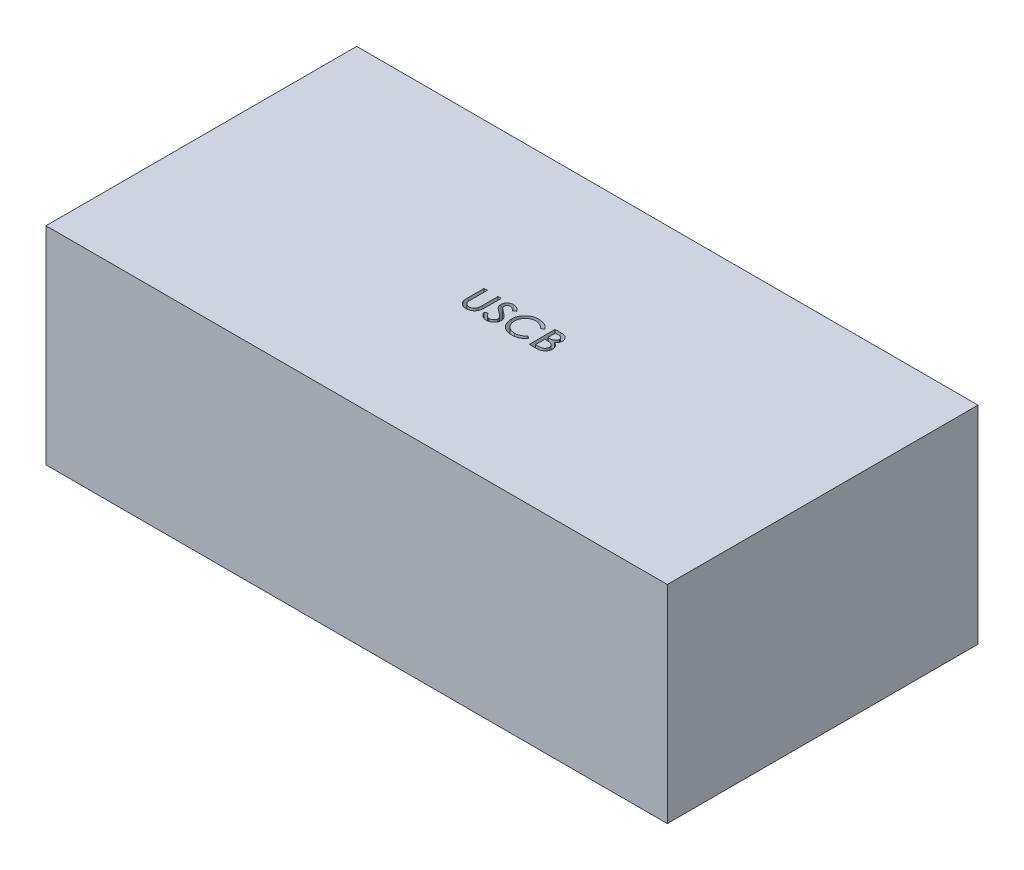
from build123d import *

# Parameters (mm, degrees)
SKETCH1_W           = 76.2
SKETCH1_H           = 38.1
BOSS_EXTRUDE1_DEPTH = 25.4
CUT_EXTRUDE1_DEPTH  = 50.595085442


with BuildPart() as part:
    # Sketch1 → Boss-Extrude1 (new body)
    with BuildSketch(Plane(origin=(0, 0, 0), x_dir=(1, 0, 0), z_dir=(0, 1, 0))):
        Rectangle(SKETCH1_W, SKETCH1_H)
    extrude(amount=BOSS_EXTRUDE1_DEPTH)

    # Sketch2 → Cut-Extrude1 (cut, through all)
    # profile 1 of 4: a face of its own
    with BuildSketch(Plane(origin=(0, 25.4, 0), x_dir=(1, 0, 0), z_dir=(0, 1, 0))):
        with BuildLine():
            Line((-4.58071498, 1.15783544), (-4.173663698, 1.15783544))
            Line((-4.173663698, 1.15783544), (-4.173663698, -0.759121691))
            add(Edge.make_bspline(
                [(-4.173663698, -0.759121691), (-4.173709576, -0.785834438), (-4.173796235, -0.836292794), (-4.173221861, -0.90795589), (-4.17183521, -0.971341599), (-4.170525458, -1.026885721), (-4.169496796, -1.074179761), (-4.167653211, -1.11341853), (-4.165195206, -1.144379332), (-4.163102951, -1.162360969), (-4.162215381, -1.169989079)],
                knots=[0, 0, 0, 0, 1.55908667, 2.944996726, 4.182614548, 5.259411187, 6.187768874, 6.943477064, 7.551805389, 8, 8, 8, 8], degree=3))
            add(Edge.make_bspline(
                [(-4.162215381, -1.169989079), (-4.157699651, -1.199988134), (-4.149063517, -1.257360002), (-4.127614846, -1.338177799), (-4.098829985, -1.409450039), (-4.063725268, -1.472755786), (-4.01890048, -1.528262144), (-3.965328334, -1.577612618), (-3.902382013, -1.622054127), (-3.831896645, -1.660492526), (-3.756739189, -1.691746244), (-3.680514713, -1.714893453), (-3.604372713, -1.729775179), (-3.553400029, -1.731414955), (-3.528105806, -1.732228662)],
                knots=[0, 0, 0, 0, 1.166957714, 2.231755086, 3.208991316, 4.118778005, 5.006904847, 5.942163703, 6.913386956, 7.965005362, 9.025668557, 10.040039382, 11.027406897, 12, 12, 12, 12], degree=3))
            add(Edge.make_bspline(
                [(-3.528105806, -1.732228662), (-3.50410258, -1.731509393), (-3.456455921, -1.730081634), (-3.386059991, -1.718180804), (-3.317579871, -1.699090781), (-3.25152961, -1.672271159), (-3.188666022, -1.638844714), (-3.130862917, -1.598627102), (-3.077944983, -1.553041736), (-3.03054433, -1.50130621), (-2.989400384, -1.442830696), (-2.952658668, -1.379361604), (-2.923554377, -1.309179216), (-2.908629276, -1.260017742), (-2.900992424, -1.234862877)],
                knots=[0, 0, 0, 0, 0.999732249, 1.98447917, 2.96624928, 3.957159324, 4.949250196, 5.927077037, 6.885351415, 7.854639871, 8.842631176, 9.859548065, 10.904776923, 12, 12, 12, 12], degree=3))
            add(Edge.make_bspline(
                [(-2.900992424, -1.234862877), (-2.898543903, -1.224073653), (-2.893101712, -1.200093056), (-2.886968287, -1.159950196), (-2.881996149, -1.112194906), (-2.878427334, -1.056594198), (-2.875312285, -0.993196562), (-2.872633661, -0.921962338), (-2.871619313, -0.843078662), (-2.871278079, -0.787954468), (-2.871099596, -0.759121691)],
                knots=[0, 0, 0, 0, 0.555909564, 1.235588686, 2.039259232, 2.968460287, 4.03530762, 5.229446682, 6.550858702, 8, 8, 8, 8], degree=3))
            Line((-2.871099596, -0.759121691), (-2.871099596, 1.15783544))
            Line((-2.871099596, 1.15783544), (-2.464048314, 1.15783544))
            Line((-2.464048314, 1.15783544), (-2.464048314, -0.752761515))
            add(Edge.make_bspline(
                [(-2.464048314, -0.752761515), (-2.464282658, -0.786474083), (-2.464741186, -0.852437566), (-2.468601497, -0.948943196), (-2.474876256, -1.040576385), (-2.483663263, -1.127359147), (-2.495356592, -1.209380918), (-2.508121022, -1.287016532), (-2.524869652, -1.359537786), (-2.543878791, -1.427849292), (-2.566866176, -1.492836145), (-2.595068477, -1.555626719), (-2.628799429, -1.616734248), (-2.668407812, -1.676062081), (-2.713775815, -1.733225987), (-2.764343865, -1.788901536), (-2.820346836, -1.842710771), (-2.880791232, -1.894770849), (-2.946267603, -1.942587725), (-3.015978404, -1.984519023), (-3.089720121, -2.019746879), (-3.167121385, -2.048187137), (-3.247984083, -2.071507048), (-3.332799269, -2.086940416), (-3.421228668, -2.096886808), (-3.481436327, -2.098003918), (-3.512205365, -2.098574816)],
                knots=[0, 0, 0, 0, 1.249746778, 2.445309111, 3.579791402, 4.654321124, 5.678008809, 6.650959404, 7.569940487, 8.435761916, 9.278480968, 10.122774478, 10.984627263, 11.863091158, 12.76404959, 13.687656952, 14.649240315, 15.641521383, 16.642911538, 17.65112545, 18.653008962, 19.667635542, 20.705108869, 21.768718231, 22.859706637, 24, 24, 24, 24], degree=3))
            add(Edge.make_bspline(
                [(-3.512205365, -2.098574816), (-3.543172762, -2.097860359), (-3.604156277, -2.096453391), (-3.693919929, -2.088442366), (-3.780180651, -2.073625185), (-3.863080214, -2.053259494), (-3.94302976, -2.027386792), (-4.019228033, -1.994463507), (-4.092924171, -1.957386409), (-4.161739238, -1.913129836), (-4.226908064, -1.865290424), (-4.285747696, -1.811961966), (-4.340651264, -1.756359537), (-4.387922434, -1.69527527), (-4.431155426, -1.631702109), (-4.467787086, -1.563720191), (-4.500328195, -1.492635251), (-4.516140953, -1.442609306), (-4.524109411, -1.417399936)],
                knots=[0, 0, 0, 0, 1.133329185, 2.231843898, 3.29426245, 4.332905112, 5.353485079, 6.365031746, 7.367763869, 8.368573437, 9.35539345, 10.32243748, 11.271609842, 12.210613971, 13.14444413, 14.081844494, 15.03339173, 16, 16, 16, 16], degree=3))
            add(Edge.make_bspline(
                [(-4.524109411, -1.417399936), (-4.528798381, -1.400496077), (-4.538913171, -1.364031995), (-4.549920273, -1.303803546), (-4.559117075, -1.234361933), (-4.567656034, -1.15572169), (-4.57279286, -1.067839418), (-4.577241697, -0.970948339), (-4.580741485, -0.864936934), (-4.580724048, -0.791137653), (-4.58071498, -0.752761515)],
                knots=[0, 0, 0, 0, 0.629181127, 1.357235188, 2.194217397, 3.14266044, 4.194662557, 5.352158634, 6.623104138, 8, 8, 8, 8], degree=3))
            Line((-4.58071498, -0.752761515), (-4.58071498, 1.15783544))
        make_face()
    # profile 2 of 4: a face of its own
    with BuildSketch(Plane(origin=(0, 25.4, 0), x_dir=(1, 0, 0), z_dir=(0, 1, 0))):
        with BuildLine():
            Line((-2.056997032, -1.387507108), (-1.711003442, -1.203061996))
            add(Edge.make_bspline(
                [(-1.711003442, -1.203061996), (-1.685788942, -1.244827869), (-1.637597048, -1.324654024), (-1.558463513, -1.432189332), (-1.479783345, -1.523888688), (-1.400779878, -1.599659503), (-1.320355695, -1.658284676), (-1.239331835, -1.700654312), (-1.157201189, -1.727285037), (-1.101670007, -1.730598504), (-1.074349796, -1.732228662)],
                knots=[0, 0, 0, 0, 1.354943589, 2.589672558, 3.704607527, 4.708856974, 5.624398268, 6.459549776, 7.242129862, 8, 8, 8, 8], degree=3))
            add(Edge.make_bspline(
                [(-1.074349796, -1.732228662), (-1.048844909, -1.731408829), (-0.998327066, -1.729784975), (-0.924100942, -1.715702161), (-0.852230401, -1.694244917), (-0.783960825, -1.663690278), (-0.720889115, -1.626257098), (-0.66521066, -1.581731936), (-0.617969043, -1.531322891), (-0.579030998, -1.475713796), (-0.548509036, -1.416340216), (-0.526040187, -1.354886922), (-0.512853214, -1.291176847), (-0.511092287, -1.24827899), (-0.51020216, -1.226594648)],
                knots=[0, 0, 0, 0, 1.0888553, 2.156709112, 3.216967111, 4.287545289, 5.343926646, 6.34269433, 7.323221176, 8.28571565, 9.233736345, 10.167849744, 11.073870434, 12, 12, 12, 12], degree=3))
            add(Edge.make_bspline(
                [(-0.51020216, -1.226594648), (-0.511449311, -1.201881342), (-0.513969519, -1.151941404), (-0.534197317, -1.077755029), (-0.56707118, -1.004294533), (-0.597480245, -0.95842851), (-0.613237016, -0.934662556)],
                knots=[0, 0, 0, 0, 0.941861274, 1.903286225, 2.913566088, 4, 4, 4, 4], degree=3))
            add(Edge.make_bspline(
                [(-0.613237016, -0.934662556), (-0.626861956, -0.917362668), (-0.655543612, -0.880944932), (-0.70409352, -0.826117466), (-0.760903285, -0.768924283), (-0.825880752, -0.709623405), (-0.897883813, -0.646886074), (-0.978135558, -0.58233377), (-1.066068663, -0.514875548), (-1.127689742, -0.469619297), (-1.159576158, -0.446201018)],
                knots=[0, 0, 0, 0, 0.718593868, 1.512701116, 2.388487339, 3.348232282, 4.383172848, 5.504845107, 6.708858268, 8, 8, 8, 8], degree=3))
            add(Edge.make_bspline(
                [(-1.159576158, -0.446201018), (-1.192091956, -0.422563084), (-1.254480668, -0.377208508), (-1.342380915, -0.310718489), (-1.421192041, -0.249411007), (-1.490309692, -0.193238144), (-1.549741724, -0.141711671), (-1.599362939, -0.095043023), (-1.64066714, -0.05451291), (-1.662862841, -0.027242349), (-1.672842384, -0.014981066)],
                knots=[0, 0, 0, 0, 1.435833971, 2.754963323, 3.936484598, 5.002077172, 5.935979083, 6.744956812, 7.435712417, 8, 8, 8, 8], degree=3))
            add(Edge.make_bspline(
                [(-1.672842384, -0.014981066), (-1.687411169, 0.003843222), (-1.716032719, 0.04082505), (-1.752268592, 0.100146297), (-1.783448749, 0.160243921), (-1.809130232, 0.221674388), (-1.829031835, 0.28424145), (-1.842723196, 0.348164524), (-1.852380845, 0.413189694), (-1.853106566, 0.457120392), (-1.853471391, 0.479204631)],
                knots=[0, 0, 0, 0, 1.064105702, 2.090521257, 3.104283852, 4.09061442, 5.065433238, 6.036507983, 7.012940167, 8, 8, 8, 8], degree=3))
            add(Edge.make_bspline(
                [(-1.853471391, 0.479204631), (-1.852322514, 0.513644634), (-1.850047822, 0.581833319), (-1.829720316, 0.681378585), (-1.796779242, 0.776227445), (-1.751815027, 0.865889679), (-1.694396544, 0.948696308), (-1.626099591, 1.023011993), (-1.546554635, 1.087250981), (-1.457884072, 1.141379128), (-1.362307659, 1.185277414), (-1.261643297, 1.216566103), (-1.157111318, 1.235534414), (-1.086088654, 1.237999435), (-1.050181126, 1.239245697)],
                knots=[0, 0, 0, 0, 1.004530234, 1.988896367, 2.951881425, 3.928924249, 4.907494835, 5.884204368, 6.865296418, 7.88218147, 8.909671266, 9.927572845, 10.952225504, 12, 12, 12, 12], degree=3))
            add(Edge.make_bspline(
                [(-1.050181126, 1.239245697), (-1.009410178, 1.237786358), (-0.928663116, 1.23489613), (-0.809634357, 1.215309525), (-0.69581362, 1.180045186), (-0.604143577, 1.141119906), (-0.532932723, 1.101321871), (-0.479074497, 1.065377432), (-0.423872593, 1.024698561), (-0.369075419, 0.977257447), (-0.312547279, 0.925349468), (-0.257182868, 0.866153026), (-0.199478464, 0.803060744), (-0.162699789, 0.757560191), (-0.143856006, 0.7342477)],
                knots=[0, 0, 0, 0, 1.360590218, 2.69465552, 4.010645498, 5.328858611, 6.009843139, 6.729980544, 7.488405022, 8.296451933, 9.147430815, 10.048128915, 10.999946711, 12, 12, 12, 12], degree=3))
            Line((-0.143856006, 0.7342477), (-0.475857208, 0.506553389))
            add(Edge.make_bspline(
                [(-0.475857208, 0.506553389), (-0.493183452, 0.525053128), (-0.526497469, 0.560623483), (-0.575501698, 0.611067681), (-0.62186638, 0.656337744), (-0.665732225, 0.696226575), (-0.706116043, 0.731445541), (-0.744152582, 0.760807051), (-0.778652391, 0.786041936), (-0.821780212, 0.811052491), (-0.874651667, 0.835822572), (-0.939724022, 0.858109963), (-1.00798212, 0.870021203), (-1.054168331, 0.87193269), (-1.077529884, 0.872899543)],
                knots=[0, 0, 0, 0, 1.253377364, 2.409930098, 3.477532466, 4.457083962, 5.341772995, 6.126101147, 6.832963523, 7.453284126, 8.588253012, 9.715448048, 10.844445545, 12, 12, 12, 12], degree=3))
            add(Edge.make_bspline(
                [(-1.077529884, 0.872899543), (-1.102465848, 0.871734233), (-1.150943398, 0.869468776), (-1.220578856, 0.85006895), (-1.284590676, 0.819456685), (-1.341067048, 0.776132133), (-1.388008441, 0.722507938), (-1.422434321, 0.659693986), (-1.442581295, 0.588109138), (-1.445104392, 0.537850077), (-1.446420109, 0.51164153)],
                knots=[0, 0, 0, 0, 1.033513523, 2.009234674, 2.977584268, 3.963375862, 4.942860848, 5.915719707, 6.913112236, 8, 8, 8, 8], degree=3))
            add(Edge.make_bspline(
                [(-1.446420109, 0.51164153), (-1.445907464, 0.494659236), (-1.444883415, 0.460735723), (-1.437361487, 0.410485355), (-1.423457207, 0.361931579), (-1.405837674, 0.314050997), (-1.381176365, 0.267112639), (-1.349768716, 0.221042387), (-1.312484938, 0.174512959), (-1.283871009, 0.145262319), (-1.26897119, 0.130030953)],
                knots=[0, 0, 0, 0, 0.940834015, 1.879392378, 2.805520916, 3.734846727, 4.701501436, 5.734192883, 6.820151034, 8, 8, 8, 8], degree=3))
            add(Edge.make_bspline(
                [(-1.26897119, 0.130030953), (-1.261426778, 0.122933542), (-1.244110769, 0.106643494), (-1.212351349, 0.081698599), (-1.173657446, 0.050424364), (-1.127492625, 0.013331239), (-1.072338883, -0.027566933), (-1.010235448, -0.075002488), (-0.939609857, -0.126839931), (-0.889910431, -0.163181495), (-0.863827961, -0.182253702)],
                knots=[0, 0, 0, 0, 0.485581606, 1.114511607, 1.892484918, 2.819534315, 3.891398566, 5.11240712, 6.484579029, 8, 8, 8, 8], degree=3))
            add(Edge.make_bspline(
                [(-0.863827961, -0.182253702), (-0.828293538, -0.20815466), (-0.759550958, -0.258260964), (-0.661899763, -0.33383973), (-0.573832177, -0.407925511), (-0.49312164, -0.477933626), (-0.422497646, -0.546800779), (-0.360636939, -0.613110978), (-0.306762665, -0.676216984), (-0.249224294, -0.756675377), (-0.191697458, -0.855866753), (-0.140256576, -0.975758167), (-0.10956019, -1.096595384), (-0.105268915, -1.177247203), (-0.103150878, -1.217054383)],
                knots=[0, 0, 0, 0, 1.186540699, 2.295404303, 3.331123753, 4.291760032, 5.17774712, 5.991329992, 6.738459906, 7.414799035, 8.65800623, 9.82461674, 10.926299804, 12, 12, 12, 12], degree=3))
            add(Edge.make_bspline(
                [(-0.103150878, -1.217054383), (-0.104052095, -1.245296998), (-0.105843333, -1.301431353), (-0.118830301, -1.38442959), (-0.140439473, -1.46510103), (-0.171528183, -1.543105024), (-0.210304956, -1.61917366), (-0.25838556, -1.692641898), (-0.315613278, -1.763226636), (-0.379573768, -1.831354392), (-0.450297921, -1.893966456), (-0.526141545, -1.94907333), (-0.606873085, -1.995109305), (-0.691870432, -2.032459509), (-0.780634861, -2.062895285), (-0.874043569, -2.083741247), (-0.971634569, -2.095773843), (-1.038063489, -2.09763132), (-1.071805726, -2.098574816)],
                knots=[0, 0, 0, 0, 0.932646097, 1.853705421, 2.767602683, 3.685675702, 4.622099834, 5.5835355, 6.579838097, 7.620108014, 8.666886363, 9.695041649, 10.711275682, 11.730160242, 12.757671447, 13.80585424, 14.885494678, 16, 16, 16, 16], degree=3))
            add(Edge.make_bspline(
                [(-1.071805726, -2.098574816), (-1.096410948, -2.098028303), (-1.144873062, -2.096951897), (-1.21681883, -2.090124066), (-1.286831026, -2.077001042), (-1.3552935, -2.060034294), (-1.422248983, -2.038429432), (-1.486834602, -2.010792852), (-1.55012586, -1.97904842), (-1.611759685, -1.941878979), (-1.671814674, -1.89835649), (-1.730632111, -1.84783544), (-1.78787034, -1.789427733), (-1.844510545, -1.723892207), (-1.899804435, -1.650491722), (-1.95362292, -1.569612244), (-2.006653166, -1.481514584), (-2.03988498, -1.41946057), (-2.056997032, -1.387507108)],
                knots=[0, 0, 0, 0, 0.916943493, 1.805999526, 2.689245248, 3.568702553, 4.433092864, 5.307568578, 6.183755457, 7.069823058, 7.986358083, 8.944343836, 9.955449961, 11.030835633, 12.170024038, 13.377301724, 14.649494474, 16, 16, 16, 16], degree=3))
        make_face()
    # profile 3 of 4: a face of its own
    with BuildSketch(Plane(origin=(0, 25.4, 0), x_dir=(1, 0, 0), z_dir=(0, 1, 0))):
        with BuildLine():
            Line((3.478900404, 0.567611081), (3.154531414, 0.343732876))
            add(Edge.make_bspline(
                [(3.154531414, 0.343732876), (3.115681397, 0.386287298), (3.039627852, 0.46959266), (2.914386448, 0.578717543), (2.783316071, 0.670563243), (2.646232161, 0.74482398), (2.50298958, 0.802958371), (2.352834858, 0.843352055), (2.195611121, 0.868245771), (2.088447122, 0.871329166), (2.033868353, 0.872899543)],
                knots=[0, 0, 0, 0, 1.078723025, 2.111729107, 3.104379151, 4.071093171, 5.02612831, 5.993405043, 6.978038489, 8, 8, 8, 8], degree=3))
            add(Edge.make_bspline(
                [(2.033868353, 0.872899543), (2.005435292, 0.872489716), (1.94887057, 0.871674407), (1.865048313, 0.862710653), (1.782508179, 0.850441776), (1.701327824, 0.831800482), (1.621651468, 0.807430472), (1.542936231, 0.77916867), (1.466374164, 0.744163612), (1.391222555, 0.70525571), (1.318608988, 0.661492943), (1.250213458, 0.612886594), (1.1847916, 0.561608568), (1.124192997, 0.505234438), (1.067864638, 0.444753589), (1.014572635, 0.380927121), (0.965663942, 0.312924832), (0.921326547, 0.240950588), (0.880884062, 0.166076784), (0.846944137, 0.087754663), (0.817477857, 0.007312898), (0.793024817, -0.075667386), (0.774939182, -0.161437532), (0.761528936, -0.249764074), (0.752935216, -0.34045137), (0.752085359, -0.401872641), (0.751656815, -0.432844648)],
                knots=[0, 0, 0, 0, 1.002068956, 1.993515617, 2.969284448, 3.943018425, 4.926742606, 5.905741285, 6.889351865, 7.892340394, 8.888397413, 9.875523532, 10.849114049, 11.817064186, 12.790109362, 13.76151668, 14.746886598, 15.740472426, 16.740336546, 17.744438579, 18.747064952, 19.759451636, 20.791569268, 21.834966327, 22.908270136, 24, 24, 24, 24], degree=3))
            add(Edge.make_bspline(
                [(0.751656815, -0.432844648), (0.752637928, -0.479337128), (0.754558487, -0.57034757), (0.773121747, -0.703609754), (0.802086988, -0.830603972), (0.842803379, -0.951320198), (0.89541378, -1.065621295), (0.959778154, -1.173319481), (1.036266873, -1.274677356), (1.123611926, -1.368384793), (1.218826284, -1.454384042), (1.322021454, -1.527964044), (1.429663689, -1.591858579), (1.543880448, -1.642590249), (1.663057756, -1.682937891), (1.78811798, -1.711518609), (1.918672642, -1.729054791), (2.007736317, -1.731159978), (2.052948882, -1.732228662)],
                knots=[0, 0, 0, 0, 1.083728652, 2.12143175, 3.131304262, 4.117911469, 5.086904967, 6.060353746, 7.03835, 8.042493243, 9.043967071, 10.025107856, 10.993520914, 11.958418665, 12.934074928, 13.923564625, 14.94591178, 16, 16, 16, 16], degree=3))
            add(Edge.make_bspline(
                [(2.052948882, -1.732228662), (2.105415002, -1.730686406), (2.209038959, -1.72764035), (2.361405093, -1.701983287), (2.508213686, -1.660542599), (2.649623248, -1.602124154), (2.785749198, -1.527301962), (2.915952041, -1.43550072), (3.04095743, -1.32755054), (3.116939755, -1.245188703), (3.155803449, -1.203061996)],
                knots=[0, 0, 0, 0, 0.996377973, 1.967910503, 2.926842387, 3.889624876, 4.868586907, 5.872161968, 6.91164629, 8, 8, 8, 8], degree=3))
            Line((3.155803449, -1.203061996), (3.478900404, -1.425668165))
            add(Edge.make_bspline(
                [(3.478900404, -1.425668165), (3.457984492, -1.452193083), (3.416427295, -1.504894645), (3.349315529, -1.579438961), (3.278823035, -1.649547595), (3.204255644, -1.714570247), (3.125693134, -1.774443673), (3.043503607, -1.829861144), (2.95776604, -1.880734516), (2.868527277, -1.92651941), (2.776295701, -1.967497479), (2.680883006, -2.002005811), (2.583203625, -2.032447814), (2.482396278, -2.056280533), (2.37885449, -2.07559628), (2.2724179, -2.08856112), (2.163551909, -2.097336234), (2.090067646, -2.098159144), (2.052948882, -2.098574816)],
                knots=[0, 0, 0, 0, 0.990136069, 1.967271632, 2.938597646, 3.903378639, 4.8655934, 5.832714132, 6.808088679, 7.786607084, 8.77175572, 9.76479442, 10.759640537, 11.769709565, 12.799869661, 13.846050076, 14.911985293, 16, 16, 16, 16], degree=3))
            add(Edge.make_bspline(
                [(2.052948882, -2.098574816), (2.018800333, -2.09834339), (1.951487349, -2.097887208), (1.852008882, -2.090222505), (1.755166543, -2.079858049), (1.661221367, -2.064308848), (1.56973006, -2.045688456), (1.481439403, -2.021000035), (1.395151541, -1.99346051), (1.312121968, -1.960155303), (1.231724645, -1.923118278), (1.153676743, -1.882526343), (1.078746099, -1.836726016), (1.00687034, -1.786162136), (0.937203434, -1.732107611), (0.870449984, -1.673358899), (0.80591544, -1.610664116), (0.766000919, -1.565435499), (0.745932656, -1.542695409)],
                knots=[0, 0, 0, 0, 1.116169561, 2.200172621, 3.260333751, 4.299600589, 5.312386579, 6.311224183, 7.295427787, 8.272379731, 9.233840239, 10.188782295, 11.146938977, 12.102635432, 13.060741968, 14.028403985, 15.00871894, 16, 16, 16, 16], degree=3))
            add(Edge.make_bspline(
                [(0.745932656, -1.542695409), (0.713762484, -1.503212783), (0.649995853, -1.424951649), (0.568724265, -1.297742318), (0.498625437, -1.16534374), (0.442929142, -1.025869567), (0.398905666, -0.88096469), (0.366818671, -0.730186948), (0.348330569, -0.573020583), (0.345861083, -0.46617775), (0.344605532, -0.411856066)],
                knots=[0, 0, 0, 0, 0.995996121, 1.974230005, 2.94855815, 3.923972302, 4.908363682, 5.909282248, 6.937024559, 8, 8, 8, 8], degree=3))
            add(Edge.make_bspline(
                [(0.344605532, -0.411856066), (0.346022993, -0.354749103), (0.348811758, -0.242394718), (0.372298347, -0.077462283), (0.410566847, 0.080311604), (0.463165893, 0.231607772), (0.532865019, 0.375188393), (0.615985101, 0.512908822), (0.716505989, 0.642202975), (0.829481101, 0.764190494), (0.953777376, 0.875830879), (1.088007971, 0.972641149), (1.229306416, 1.055370368), (1.378193074, 1.123140735), (1.535071371, 1.175641116), (1.699681956, 1.211961129), (1.871671883, 1.234959109), (1.98884901, 1.237799716), (2.048496758, 1.239245697)],
                knots=[0, 0, 0, 0, 1.034323922, 2.034967744, 3.011348252, 3.972313581, 4.931003742, 5.898099022, 6.881526582, 7.89265862, 8.907395938, 9.903191422, 10.886146247, 11.869423756, 12.861842533, 13.877618994, 14.91962492, 16, 16, 16, 16], degree=3))
            add(Edge.make_bspline(
                [(2.048496758, 1.239245697), (2.086037008, 1.238811017), (2.160363194, 1.237950393), (2.27056028, 1.22944702), (2.377960882, 1.215489522), (2.482586449, 1.196263737), (2.584746655, 1.172506414), (2.683900821, 1.141528882), (2.780610788, 1.106141007), (2.874225575, 1.065283908), (2.964515463, 1.019832332), (3.05045682, 0.968557132), (3.132643484, 0.913426266), (3.210420352, 0.853290629), (3.284305822, 0.789141737), (3.353939051, 0.720241239), (3.418957239, 0.646309702), (3.458852449, 0.593931788), (3.478900404, 0.567611081)],
                knots=[0, 0, 0, 0, 1.097463626, 2.172875475, 3.229307817, 4.262776093, 5.282168658, 6.293918414, 7.298043722, 8.291879901, 9.278790577, 10.251524626, 11.216027204, 12.170719329, 13.124142787, 14.075306658, 15.032812027, 16, 16, 16, 16], degree=3))
        make_face()
    # profile 4 of 4: a face of its own
    with BuildSketch(Plane(origin=(0, 25.4, 0), x_dir=(1, 0, 0), z_dir=(0, 1, 0))):
        with BuildLine():
            Line((4.130182456, 1.15783544), (4.775104331, 1.15783544))
            add(Edge.make_bspline(
                [(4.775104331, 1.15783544), (4.806701987, 1.157726987), (4.868034471, 1.157516474), (4.957327679, 1.152008295), (5.041316935, 1.144425725), (5.120221426, 1.13487064), (5.193527819, 1.120425085), (5.26164269, 1.104349949), (5.324371797, 1.084604706), (5.399696128, 1.054356344), (5.485847332, 1.009756571), (5.57716289, 0.942765498), (5.656582232, 0.864334966), (5.722274981, 0.774719344), (5.774244248, 0.677501636), (5.812428861, 0.57537812), (5.835275516, 0.468976215), (5.83828519, 0.396630173), (5.83979784, 0.360269335)],
                knots=[0, 0, 0, 0, 1.007958579, 1.956493294, 2.853051435, 3.69876748, 4.490758369, 5.235590101, 5.930857791, 6.586533057, 7.824014415, 9.014592828, 10.186442765, 11.371570779, 12.545761065, 13.692928573, 14.840474926, 16, 16, 16, 16], degree=3))
            add(Edge.make_bspline(
                [(5.83979784, 0.360269335), (5.838499925, 0.326272833), (5.835934758, 0.25908301), (5.817708282, 0.160019395), (5.787116458, 0.064872251), (5.744421885, -0.024871378), (5.692834094, -0.107736735), (5.629254484, -0.178331724), (5.557777533, -0.238467815), (5.503298723, -0.267538973), (5.475995757, -0.28210847)],
                knots=[0, 0, 0, 0, 1.049068526, 2.073352407, 3.097740801, 4.125217979, 5.134529868, 6.0985968, 7.047080017, 8, 8, 8, 8], degree=3))
            add(Edge.make_bspline(
                [(5.475995757, -0.28210847), (5.508476168, -0.292892511), (5.571672018, -0.313874592), (5.660170433, -0.355744718), (5.740295797, -0.404572762), (5.811261343, -0.461666515), (5.873465515, -0.525008898), (5.928915394, -0.592825143), (5.97618901, -0.666172769), (6.01462081, -0.744759635), (6.046322688, -0.826475519), (6.067462366, -0.911790142), (6.081592767, -0.999277717), (6.083211698, -1.058629803), (6.084028609, -1.088578823)],
                knots=[0, 0, 0, 0, 1.133419977, 2.205250392, 3.236826218, 4.236512947, 5.215313127, 6.174419893, 7.135300951, 8.100002318, 9.069604306, 10.034177721, 11.008047523, 12, 12, 12, 12], degree=3))
            add(Edge.make_bspline(
                [(6.084028609, -1.088578823), (6.083177951, -1.119575686), (6.081497657, -1.180803341), (6.067972189, -1.27109889), (6.044660799, -1.357848794), (6.013690361, -1.441938352), (5.972464454, -1.522311023), (5.922602361, -1.599643809), (5.863625708, -1.673594213), (5.796773059, -1.743861767), (5.721849723, -1.808220412), (5.639647303, -1.864172823), (5.55093725, -1.911635988), (5.455737156, -1.950649977), (5.353503807, -1.980170132), (5.245032375, -2.001863438), (5.130092544, -2.014579039), (5.05137968, -2.016288869), (5.011066871, -2.01716456)],
                knots=[0, 0, 0, 0, 0.936774787, 1.85039767, 2.752028152, 3.648404466, 4.554125646, 5.47676296, 6.425627069, 7.40928418, 8.404729492, 9.405524488, 10.409085955, 11.440939351, 12.509690097, 13.620780345, 14.781482169, 16, 16, 16, 16], degree=3))
            Line((5.011066871, -2.01716456), (4.130182456, -2.01716456))
            Line((4.130182456, -2.01716456), (4.130182456, 1.15783544))
        make_face()
        with BuildLine():
            Line((4.537233738, 0.791489286), (4.537233738, -0.144728662))
            Line((4.537233738, -0.144728662), (4.639632576, -0.144728662))
            add(Edge.make_bspline(
                [(4.639632576, -0.144728662), (4.666138638, -0.144748668), (4.717052535, -0.144787096), (4.790618085, -0.141127719), (4.858517082, -0.137036032), (4.920922865, -0.130808257), (4.977509058, -0.122359679), (5.028865619, -0.113310616), (5.074242266, -0.101186281), (5.126900994, -0.083650242), (5.185155569, -0.055800186), (5.247943861, -0.01481479), (5.302674341, 0.034777306), (5.348795251, 0.092073225), (5.386645892, 0.1548109), (5.41330191, 0.222091999), (5.430133047, 0.292661758), (5.431866615, 0.340881564), (5.432746558, 0.365357476)],
                knots=[0, 0, 0, 0, 1.189795604, 2.285406617, 3.306016107, 4.243629591, 5.09972607, 5.874440047, 6.583200089, 7.20625147, 8.364329942, 9.470433385, 10.562068177, 11.665054906, 12.761988123, 13.838370909, 14.902777763, 16, 16, 16, 16], degree=3))
            add(Edge.make_bspline(
                [(5.432746558, 0.365357476), (5.432519513, 0.381503107), (5.432075045, 0.413110041), (5.424539579, 0.458831586), (5.414050745, 0.502323834), (5.397970379, 0.542722277), (5.378133798, 0.580798509), (5.353799912, 0.616262601), (5.324213661, 0.648407065), (5.291030227, 0.678824715), (5.252491822, 0.705837162), (5.208159012, 0.728348973), (5.158740367, 0.748522608), (5.103335605, 0.76375738), (5.042447228, 0.776791567), (4.975866004, 0.785318851), (4.903658234, 0.79033558), (4.853767266, 0.791095297), (4.827893794, 0.791489286)],
                knots=[0, 0, 0, 0, 0.920588044, 1.802157111, 2.638793445, 3.470424406, 4.277107445, 5.086238418, 5.917516993, 6.765890369, 7.652348103, 8.594329737, 9.598999334, 10.694623565, 11.869668103, 13.151790333, 14.522917531, 16, 16, 16, 16], degree=3))
            Line((4.827893794, 0.791489286), (4.537233738, 0.791489286))
        make_face(mode=Mode.SUBTRACT)
        with BuildLine():
            Line((4.537233738, -0.511074816), (4.537233738, -1.650818406))
            Line((4.537233738, -1.650818406), (4.848882375, -1.650818406))
            add(Edge.make_bspline(
                [(4.848882375, -1.650818406), (4.876231373, -1.650462205), (4.929032369, -1.649774509), (5.00520914, -1.647688299), (5.075621774, -1.642407715), (5.140123134, -1.635566641), (5.199036023, -1.627021071), (5.251555512, -1.615333627), (5.29875079, -1.602987539), (5.35307028, -1.582817582), (5.413863306, -1.551535948), (5.479964582, -1.506224874), (5.537354169, -1.450784989), (5.586753958, -1.388082416), (5.626970911, -1.319707773), (5.655601063, -1.247396548), (5.673767508, -1.172575149), (5.675903711, -1.121753204), (5.676977327, -1.096211034)],
                knots=[0, 0, 0, 0, 1.163785926, 2.246848597, 3.241725633, 4.167152819, 5.00659376, 5.772700295, 6.455464292, 7.08048881, 8.234268396, 9.355318846, 10.478218647, 11.615125307, 12.742977958, 13.840148171, 14.914498376, 16, 16, 16, 16], degree=3))
            add(Edge.make_bspline(
                [(5.676977327, -1.096211034), (5.675701126, -1.064237979), (5.673194636, -1.001442151), (5.647644575, -0.911007427), (5.607686728, -0.826720983), (5.551916146, -0.749776717), (5.482281029, -0.681282809), (5.399105966, -0.624365878), (5.303587181, -0.579351347), (5.234438456, -0.559498691), (5.198692071, -0.549235874)],
                knots=[0, 0, 0, 0, 0.973192407, 1.911372656, 2.842841623, 3.806662698, 4.794486549, 5.808057144, 6.866876674, 8, 8, 8, 8], degree=3))
            add(Edge.make_bspline(
                [(5.198692071, -0.549235874), (5.18388147, -0.546098879), (5.152082277, -0.539363576), (5.100189607, -0.532276264), (5.041315396, -0.524870268), (4.974835522, -0.520462153), (4.901098017, -0.515471578), (4.81984057, -0.513600871), (4.731231615, -0.511318481), (4.669739562, -0.511158242), (4.637724523, -0.511074816)],
                knots=[0, 0, 0, 0, 0.644909758, 1.384657469, 2.230684102, 3.173004705, 4.222865052, 5.379792601, 6.635823043, 8, 8, 8, 8], degree=3))
            Line((4.637724523, -0.511074816), (4.537233738, -0.511074816))
        make_face(mode=Mode.SUBTRACT)
    extrude(amount=-CUT_EXTRUDE1_DEPTH, mode=Mode.SUBTRACT)


with BuildPart() as cut_extrude1_piece_1:
    # of the separate pieces the step leaves, piece 1, a body of its own (cut_extrude1_pieces)
    add(part.part.solids().sort_by_distance((-38.1, 0, 19.05))[0])


with BuildPart() as cut_extrude1_piece_2:
    # of the separate pieces the step leaves, piece 2, a body of its own (cut_extrude1_pieces)
    add(part.part.solids().sort_by_distance((4.637724523, 0, 0.511074816))[0])


with BuildPart() as cut_extrude1_piece_3:
    # of the separate pieces the step leaves, piece 3, a body of its own (cut_extrude1_pieces)
    add(part.part.solids().sort_by_distance((4.827893794, 0, -0.791489286))[0])


solid = Compound([cut_extrude1_piece_1.part, cut_extrude1_piece_2.part, cut_extrude1_piece_3.part])
